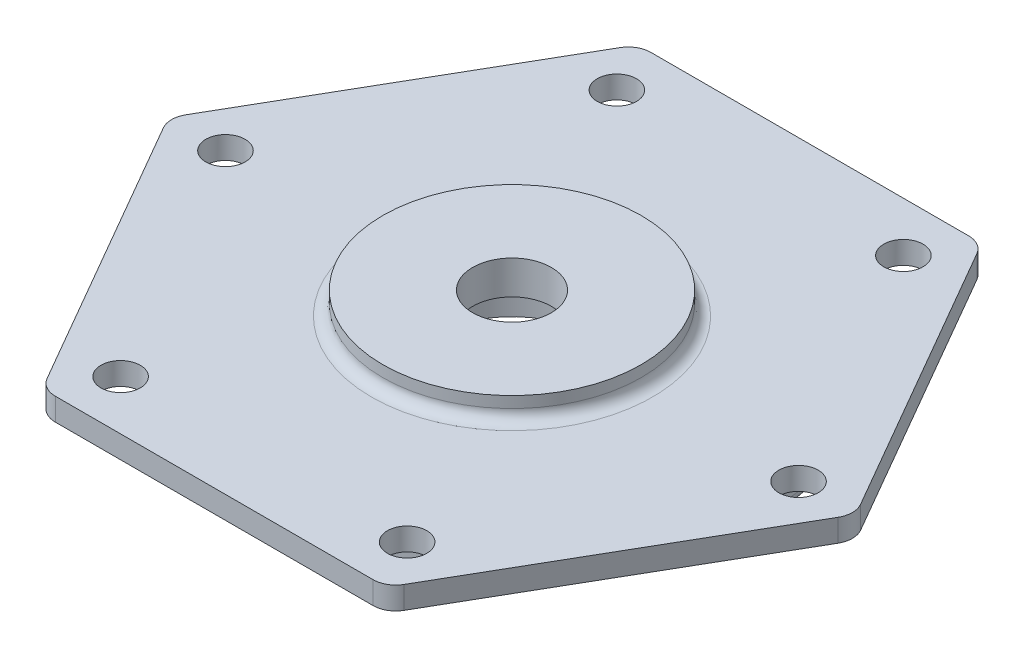
from build123d import *

# Parameters (mm, degrees)
BOSS_EXTRUDE1_DEPTH = 4
SKETCH2_R           = 23
BOSS_EXTRUDE2_DEPTH = 4
SKETCH3_R           = 45
BOSS_EXTRUDE3_DEPTH = 6
SKETCH4_R           = 40
SKETCH4_R_2         = 19
CUT_EXTRUDE1_DEPTH  = 6
SKETCH5_R           = 14
CUT_EXTRUDE2_DEPTH  = 8
SKETCH6_R           = 7
CUT_EXTRUDE3_DEPTH  = 81.888663881
FILLET1_R           = 2
SKETCH7_R           = 3.5
CUT_EXTRUDE4_DEPTH  = 82.110886719


with BuildPart() as part:
    # Sketch1 → Boss-Extrude1 (new body)
    with BuildSketch(Plane(origin=(0, 0, 0), x_dir=(1, 0, 0), z_dir=(0, 1, 0))):
        with BuildLine():
            Line((60.044427996, 2), (31.754264805, 51))
            ThreePointArc((31.754264805, 51), (30.29016319, 52.464101615), (28.29016319, 53))
            Line((28.29016319, 53), (-28.29016319, 53))
            ThreePointArc((-28.29016319, 53), (-30.29016319, 52.464101615), (-31.754264805, 51))
            Line((-31.754264805, 51), (-60.044427996, 2))
            ThreePointArc((-60.044427996, 2), (-60.580326381, 0), (-60.044427996, -2))
            Line((-60.044427996, -2), (-31.754264805, -51))
            ThreePointArc((-31.754264805, -51), (-30.29016319, -52.464101615), (-28.29016319, -53))
            Line((-28.29016319, -53), (28.29016319, -53))
            ThreePointArc((28.29016319, -53), (30.29016319, -52.464101615), (31.754264805, -51))
            Line((31.754264805, -51), (60.044427996, -2))
            ThreePointArc((60.044427996, -2), (60.580326381, 0), (60.044427996, 2))
        make_face()
    extrude(amount=BOSS_EXTRUDE1_DEPTH)

    # Sketch2 → Boss-Extrude2 (add)
    with BuildSketch(Plane(origin=(0, 4, 0), x_dir=(1, 0, 0), z_dir=(0, 1, 0))):
        with Locations(Location((0, 0, 0), (0, 0, 270))):
            Circle(SKETCH2_R)
    extrude(amount=BOSS_EXTRUDE2_DEPTH)

    # Sketch3 → Boss-Extrude3 (add)
    with BuildSketch(Plane.XZ):
        with Locations(Location((0, 0, 0), (0, 0, 270))):
            Circle(SKETCH3_R)
    extrude(amount=BOSS_EXTRUDE3_DEPTH)

    # Sketch4 → Cut-Extrude1 (cut)
    with BuildSketch(Plane.XZ.offset(6)):
        with Locations(Location((0, 0, 0), (0, 0, 270))):
            Circle(SKETCH4_R)
        with Locations(Location((0, 0, 0), (0, 0, 270))):
            Circle(SKETCH4_R_2, mode=Mode.SUBTRACT)
    extrude(amount=-CUT_EXTRUDE1_DEPTH, mode=Mode.SUBTRACT)

    # Sketch5 → Cut-Extrude2 (cut)
    with BuildSketch(Plane.XZ.offset(6)):
        with Locations(Location((0, 0, 0), (0, 0, 270))):
            Circle(SKETCH5_R)
    extrude(amount=-CUT_EXTRUDE2_DEPTH, mode=Mode.SUBTRACT)

    # Sketch6 → Cut-Extrude3 (cut, through all)
    with BuildSketch(Plane.XZ.offset(-2)):
        with Locations(Location((0, 0, 0), (0, 0, 270))):
            Circle(SKETCH6_R)
    extrude(amount=-CUT_EXTRUDE3_DEPTH, mode=Mode.SUBTRACT)

    # Fillet1
    fillet1_edges = [part.edges().sort_by_distance(p)[0] for p in [
        (0, 4, -23),
        (0, -6, 45),
        (0, -6, 19),
    ]]
    fillet(fillet1_edges, radius=FILLET1_R)

    # Sketch7 → Cut-Extrude4 (cut, through all)
    with BuildSketch(Plane(origin=(0, 4, 0), x_dir=(1, 0, 0), z_dir=(0, 1, 0))):
        with Locations(Location((51, 0, 0), (0, 0, 270))):
            Circle(SKETCH7_R)
        with Locations(Location((25.5, -44.167295593, 0), (0, 0, 270))):
            Circle(SKETCH7_R)
        with Locations(Location((-25.5, -44.167295593, 0), (0, 0, 270))):
            Circle(SKETCH7_R)
        with Locations(Location((-51, 0, 0), (0, 0, 270))):
            Circle(SKETCH7_R)
        with Locations(Location((-25.5, 44.167295593, 0), (0, 0, 270))):
            Circle(SKETCH7_R)
        with Locations(Location((25.5, 44.167295593, 0), (0, 0, 270))):
            Circle(SKETCH7_R)
    extrude(amount=-CUT_EXTRUDE4_DEPTH, mode=Mode.SUBTRACT)


solid = part.part
